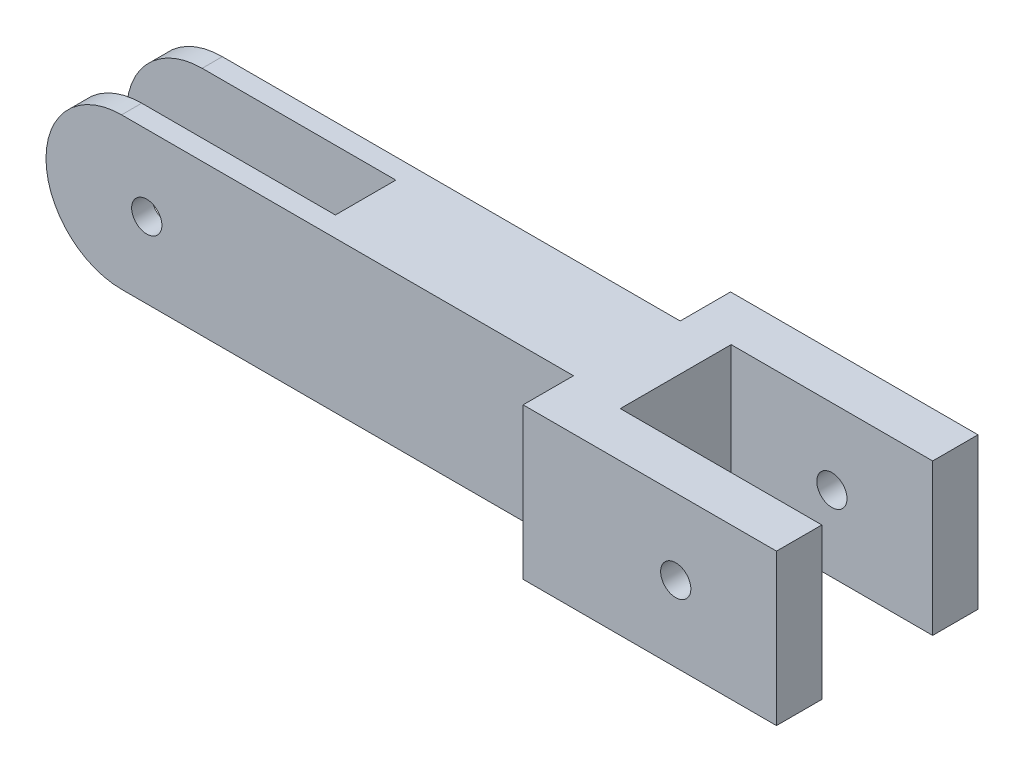
from build123d import *

# Parameters (mm, degrees)
Y_KSEKLIK_EKSTR_ZYON1_DEPTH = 10
KES_EKSTR_ZYON1_DEPTH       = 3
IZIM4_R                     = 1.5
KES_EKSTR_ZYON2_DEPTH       = 7.5
IZIM5_W                     = 20
IZIM5_H                     = 16.82010055
KES_EKSTR_ZYON4_DEPTH       = 5.5
IZIM6_R                     = 1.5
KES_EKSTR_ZYON5_DEPTH       = 19
KES_EKSTR_ZYON6_DEPTH       = 12


with BuildPart() as part:
    # Çizim1 → Yükseklik-Ekstrüzyon1 (new, symmetric)
    with BuildSketch(Plane.XY):
        with BuildLine():
            Line((-12.5, 7.5), (57.5, 7.5))
            Line((57.5, 7.5), (57.5, -7.5))
            Line((57.5, -7.5), (-12.5, -7.5))
            ThreePointArc((-12.5, -7.5), (-20, 0), (-12.5, 7.5))
        make_face()
    extrude(amount=Y_KSEKLIK_EKSTR_ZYON1_DEPTH, both=True)

    # Çizim2 → Kes-Ekstrüzyon1 (cut, symmetric)
    with BuildSketch(Plane.XY):
        with BuildLine():
            Line((6.719945644, -7.5), (-13.280054356, -7.5))
            ThreePointArc((-13.280054356, -7.5), (-20.780054356, 0), (-13.280054356, 7.5))
            Line((-13.280054356, 7.5), (6.719945644, 7.5))
            Line((6.719945644, 7.5), (6.719945644, -7.5))
        make_face()
    extrude(amount=KES_EKSTR_ZYON1_DEPTH, both=True, mode=Mode.SUBTRACT)

    # Çizim4 → Kes-Ekstrüzyon2 (cut, symmetric)
    with BuildSketch(Plane.XY):
        with Locations((-10, 0)):
            Circle(IZIM4_R)
    extrude(amount=KES_EKSTR_ZYON2_DEPTH, both=True, mode=Mode.SUBTRACT)

    # Çizim5 → Kes-Ekstrüzyon4 (cut, symmetric)
    with BuildSketch(Plane.XY):
        with Locations((47.5, -0.910050275)):
            Rectangle(IZIM5_W, IZIM5_H)
    extrude(amount=KES_EKSTR_ZYON4_DEPTH, both=True, mode=Mode.SUBTRACT)

    # Çizim6 → Kes-Ekstrüzyon5 (cut)
    with BuildSketch(Plane.XY.offset(10)):
        with Locations((47.5, 0)):
            Circle(IZIM6_R)
    extrude(amount=-KES_EKSTR_ZYON5_DEPTH, mode=Mode.SUBTRACT)

    # Çizim7 → Kes-Ekstrüzyon6 (cut, symmetric)
    with BuildSketch(Plane(origin=(0, 0, 0), x_dir=(1, 0, 0), z_dir=(0, 1, 0))):
        Polygon((32.353261004, -10), (32.353261004, -5), (-23.403314964, -5), (-23.403314964, 5), (32.941056233, 5), (32.941056233, 10), (-29.197296503, 10), (-29.197296503, -10), align=None)
    extrude(amount=KES_EKSTR_ZYON6_DEPTH, both=True, mode=Mode.SUBTRACT)


solid = part.part
